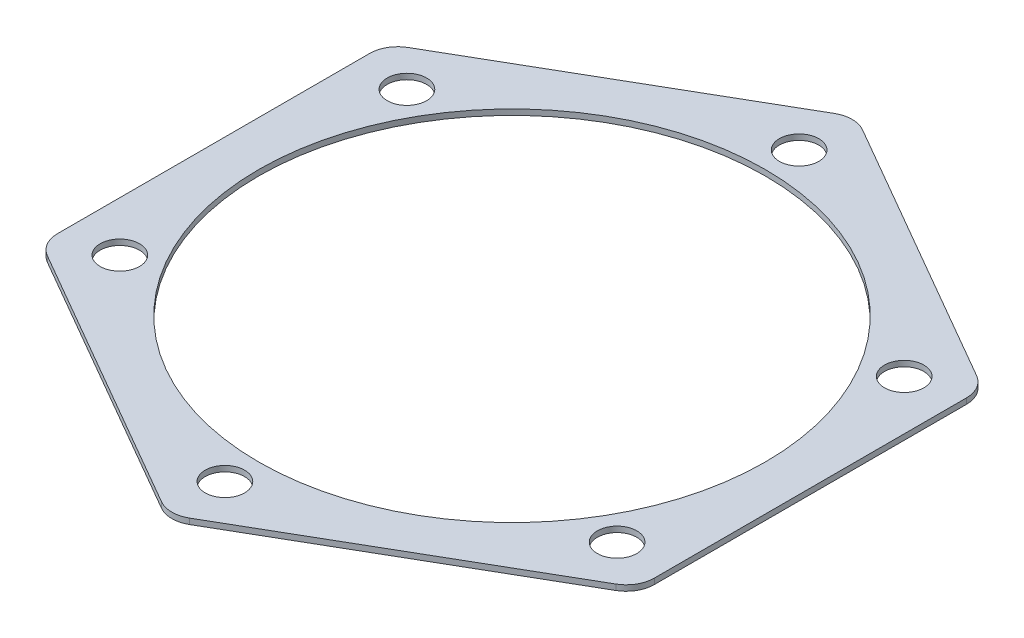
from build123d import *

# Parameters (mm, degrees)
SKETCH1_R           = 45
SKETCH1_R_2         = 3.5
BOSS_EXTRUDE2_DEPTH = 1


with BuildPart() as part:
    # Sketch1 → Boss-Extrude2 (new body)
    with BuildSketch(Plane(origin=(0, 0, 0), x_dir=(1, 0, 0), z_dir=(0, 1, 0))):
        with BuildLine():
            Line((53, -27.712812921), (53, 27.712812921))
            ThreePointArc((53, 27.712812921), (52.330127019, 30.212812921), (50.5, 32.04293994))
            Line((50.5, 32.04293994), (2.5, 59.755752861))
            ThreePointArc((2.5, 59.755752861), (0, 60.425625842), (-2.5, 59.755752861))
            Line((-2.5, 59.755752861), (-50.5, 32.04293994))
            ThreePointArc((-50.5, 32.04293994), (-52.330127019, 30.212812921), (-53, 27.712812921))
            Line((-53, 27.712812921), (-53, -27.712812921))
            ThreePointArc((-53, -27.712812921), (-52.330127019, -30.212812921), (-50.5, -32.04293994))
            Line((-50.5, -32.04293994), (-2.5, -59.755752861))
            ThreePointArc((-2.5, -59.755752861), (0, -60.425625842), (2.5, -59.755752861))
            Line((2.5, -59.755752861), (50.5, -32.04293994))
            ThreePointArc((50.5, -32.04293994), (52.330127019, -30.212812921), (53, -27.712812921))
        make_face()
        with Locations(Location((0, 0, 0), (0, 0, 270))):
            Circle(SKETCH1_R, mode=Mode.SUBTRACT)
        with Locations(Location((0, 51, 0), (0, 0, 270))):
            Circle(SKETCH1_R_2, mode=Mode.SUBTRACT)
        with Locations(Location((44.167295593, 25.5, 0), (0, 0, 270))):
            Circle(SKETCH1_R_2, mode=Mode.SUBTRACT)
        with Locations(Location((44.167295593, -25.5, 0), (0, 0, 270))):
            Circle(SKETCH1_R_2, mode=Mode.SUBTRACT)
        with Locations(Location((0, -51, 0), (0, 0, 270))):
            Circle(SKETCH1_R_2, mode=Mode.SUBTRACT)
        with Locations(Location((-44.167295593, -25.5, 0), (0, 0, 270))):
            Circle(SKETCH1_R_2, mode=Mode.SUBTRACT)
        with Locations(Location((-44.167295593, 25.5, 0), (0, 0, 270))):
            Circle(SKETCH1_R_2, mode=Mode.SUBTRACT)
    extrude(amount=BOSS_EXTRUDE2_DEPTH)


solid = part.part
